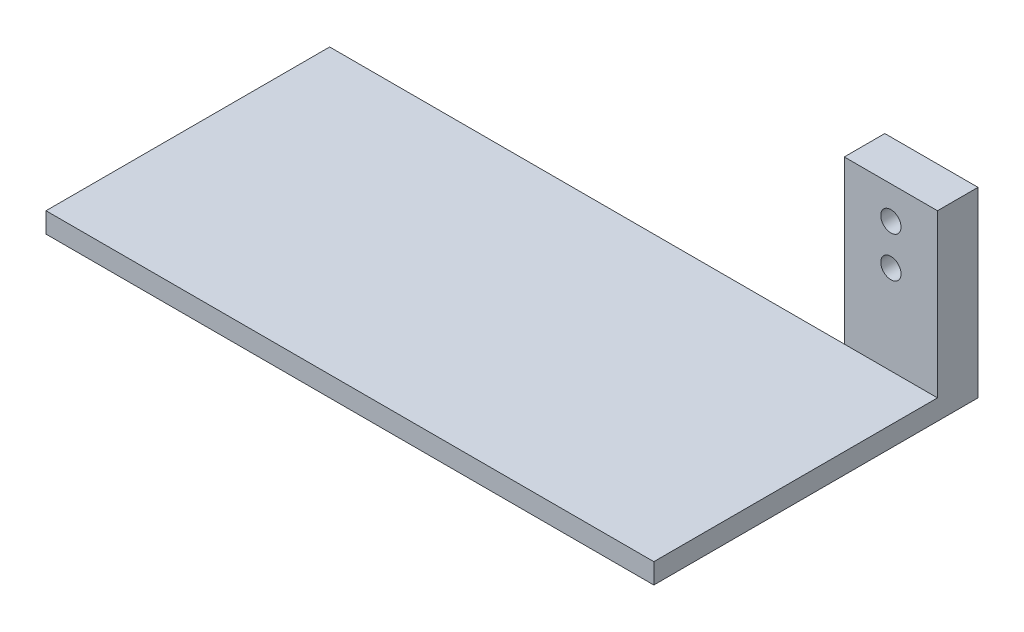
from build123d import *

# Parameters (mm, degrees)
SKETCH2_W           = 23
SKETCH2_H           = 10
BOSS_EXTRUDE1_DEPTH = 40
SKETCH3_R           = 2.5
CUT_EXTRUDE1_DEPTH  = 43.804789452
SKETCH4_W           = 150
SKETCH4_H           = 5
BOSS_EXTRUDE2_DEPTH = 70
SKETCH5_W           = 23
SKETCH5_H           = 10
BOSS_EXTRUDE3_DEPTH = 5


with BuildPart() as part:
    # Sketch2 → Boss-Extrude1 (new body)
    with BuildSketch(Plane(origin=(0, 0, 0), x_dir=(1, 0, 0), z_dir=(0, 1, 0))):
        Rectangle(SKETCH2_W, SKETCH2_H)
    extrude(amount=BOSS_EXTRUDE1_DEPTH)

    # Sketch3 → Cut-Extrude1 (cut, through all)
    with BuildSketch(Plane.XY.offset(5)):
        with Locations((0, 32)):
            Circle(SKETCH3_R)
        with Locations((0, 22)):
            Circle(SKETCH3_R)
    extrude(amount=-CUT_EXTRUDE1_DEPTH, mode=Mode.SUBTRACT)



with BuildPart() as body_2:
    # Sketch4 → Boss-Extrude2 (new body)
    with BuildSketch(Plane.XY.offset(5)):
        with Locations((-63.5, -2.5)):
            Rectangle(SKETCH4_W, SKETCH4_H)
    extrude(amount=BOSS_EXTRUDE2_DEPTH)


with BuildPart() as part_1:
    add(part.part)

    add(body_2.part)  # Boss-Extrude3 merges body 2
    # Sketch5 → Boss-Extrude3 (add)
    with BuildSketch(Plane.XZ):
        Rectangle(SKETCH5_W, SKETCH5_H)
    extrude(amount=BOSS_EXTRUDE3_DEPTH)


solid = part_1.part
